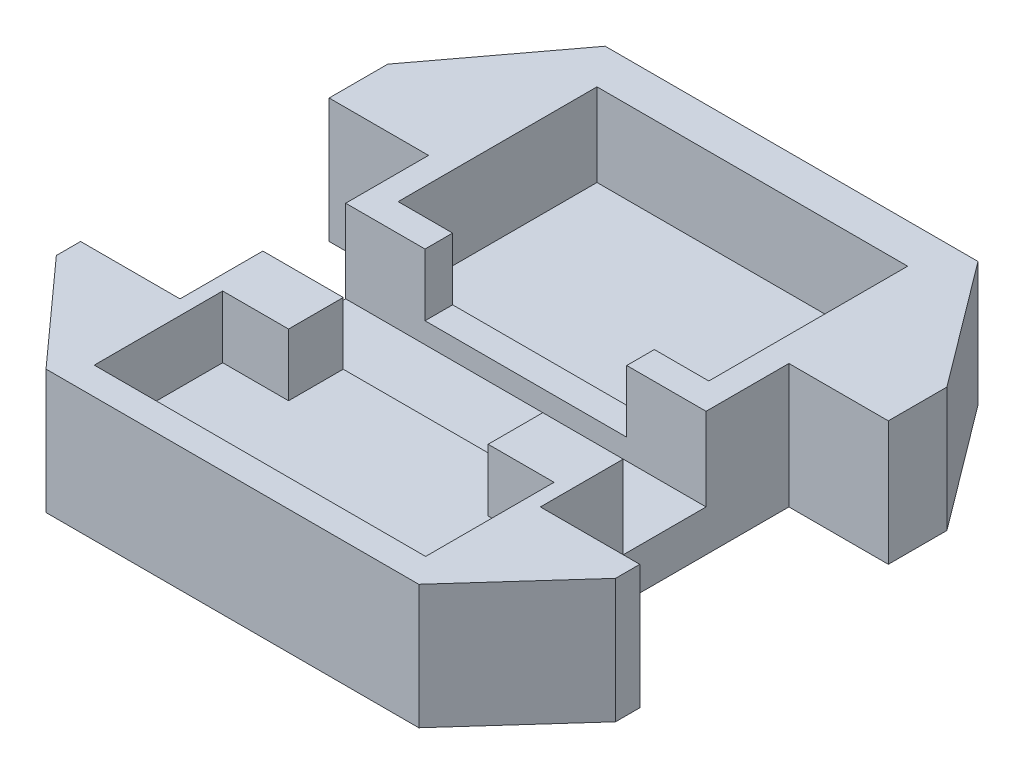
from build123d import *

# Parameters (mm, degrees)
RESSALTO_EXTRUS_O1_DEPTH   = 30
CORTE_EXTRUS_O1_DEPTH      = 117.431310222
CORTE_EXTRUS_O1_DEPTH_BACK = 117.431310222
ESBO_O3_W                  = 24
ESBO_O3_H                  = 60
ESBO_O4_W                  = 122.227571884
ESBO_O4_H                  = 20
CORTE_EXTRUS_O3_DEPTH      = 20
ESBO_O6_W                  = 80
ESBO_O6_H                  = 31
CORTE_EXTRUS_O5_DEPTH      = 15
ESBO_O8_W                  = 48.18
ESBO_O8_H                  = 13.200484169
CORTE_EXTRUS_O6_DEPTH      = 15
ESBO_O9_W                  = 75
ESBO_O9_H                  = 48
CORTE_EXTRUS_O7_DEPTH      = 20
ESBO_O10_W                 = 48.7
ESBO_O10_H                 = 6.666237126
CORTE_EXTRUS_O8_DEPTH      = 15


with BuildPart() as part:
    # Esboço2 → Ressalto-extrusão1 (new body)
    with BuildSketch(Plane(origin=(0, 0, 0), x_dir=(1, 0, 0), z_dir=(0, 1, 0))):
        Polygon((-45, -45), (45, -45), (67.5, -20), (67.5, 60), (45, 90), (-45, 90), (-67.5, 60), (-67.5, -20), align=None)
    extrude(amount=RESSALTO_EXTRUS_O1_DEPTH)

    # Esboço3 → Corte-extrusão1 (cut, two sides: drawn at the far end of the back side and taken through both)
    with BuildSketch(Plane(origin=(0, 30, 0), x_dir=(1, 0, 0), z_dir=(0, 1, 0)).offset(-CORTE_EXTRUS_O1_DEPTH_BACK)):
        with Locations((-55.5, 15.849651962)):
            Rectangle(ESBO_O3_W, ESBO_O3_H)
        with Locations((55.5, 15.849651962)):
            Rectangle(ESBO_O3_W, ESBO_O3_H)
    extrude(amount=CORTE_EXTRUS_O1_DEPTH + CORTE_EXTRUS_O1_DEPTH_BACK, mode=Mode.SUBTRACT)

    # Esboço4 → Corte-extrusão3 (cut)
    with BuildSketch(Plane(origin=(0, 30, 0), x_dir=(1, 0, 0), z_dir=(0, 1, 0))):
        with Locations((-2.959415656, 15.849651962)):
            Rectangle(ESBO_O4_W, ESBO_O4_H)
    extrude(amount=-CORTE_EXTRUS_O3_DEPTH, mode=Mode.SUBTRACT)

    # Esboço6 → Corte-extrusão5 (cut)
    with BuildSketch(Plane(origin=(0, 30, 0), x_dir=(1, 0, 0), z_dir=(0, 1, 0))):
        with Locations((0, -22.850832207)):
            Rectangle(ESBO_O6_W, ESBO_O6_H)
    extrude(amount=-CORTE_EXTRUS_O5_DEPTH, mode=Mode.SUBTRACT)

    # Esboço8 → Corte-extrusão6 (cut)
    with BuildSketch(Plane(origin=(0, 30, 0), x_dir=(1, 0, 0), z_dir=(0, 1, 0))):
        with Locations((0, -0.750590123)):
            Rectangle(ESBO_O8_W, ESBO_O8_H)
    extrude(amount=-CORTE_EXTRUS_O6_DEPTH, mode=Mode.SUBTRACT)

    # Esboço9 → Corte-extrusão7 (cut)
    with BuildSketch(Plane(origin=(0, 30, 0), x_dir=(1, 0, 0), z_dir=(0, 1, 0))):
        with Locations((0, 56.515889088)):
            Rectangle(ESBO_O9_W, ESBO_O9_H)
    extrude(amount=-CORTE_EXTRUS_O7_DEPTH, mode=Mode.SUBTRACT)

    # Esboço10 → Corte-extrusão8 (cut)
    with BuildSketch(Plane(origin=(0, 30, 0), x_dir=(1, 0, 0), z_dir=(0, 1, 0))):
        with Locations((0, 29.182770525)):
            Rectangle(ESBO_O10_W, ESBO_O10_H)
    extrude(amount=-CORTE_EXTRUS_O8_DEPTH, mode=Mode.SUBTRACT)


solid = part.part
